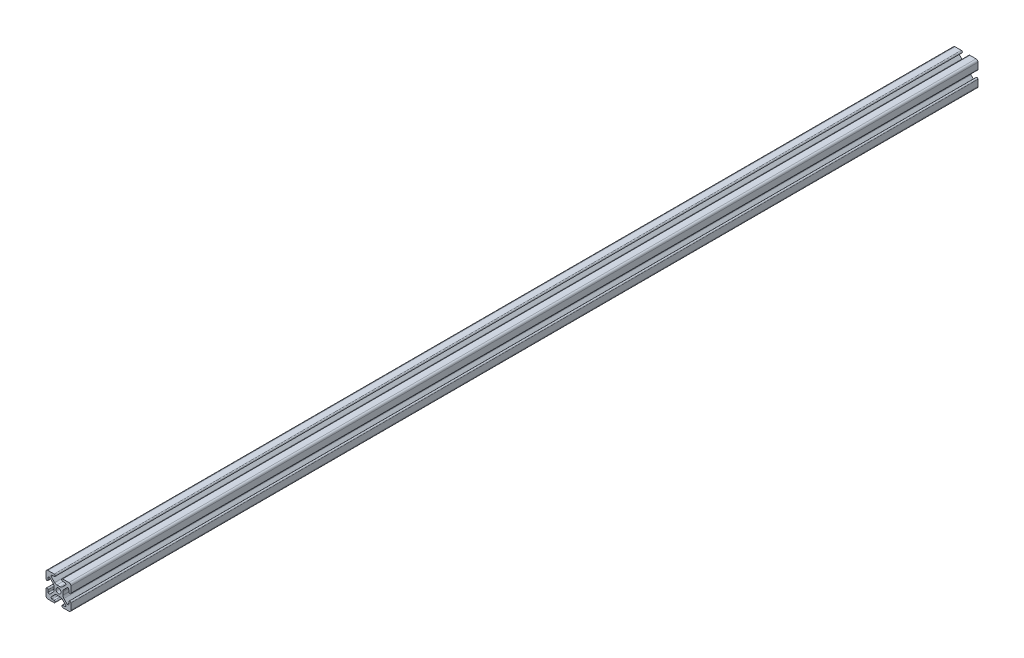
from build123d import *

# Parameters (mm, degrees)
SKETCH1_R      = 2.5
EXTRUDE1_DEPTH = 911


with BuildPart() as part:
    # Sketch1 → Extrude1 (new body)
    with BuildSketch(Plane.XY):
        with BuildLine():
            Line((-8.636346088, 7.111588351), (-5.432204773, 3.912143135))
            ThreePointArc((-5.432204773, 3.912143135), (-4.708985779, 2.831057106), (-4.455, 1.555406707))
            Line((-4.455, 1.555406707), (-4.455, -1.555406707))
            ThreePointArc((-4.455, -1.555406707), (-4.708985779, -2.831057106), (-5.432204773, -3.912143135))
            Line((-5.432204773, -3.912143135), (-8.636346088, -7.111588351))
            ThreePointArc((-8.636346088, -7.111588351), (-9.736852394, -7.329863489), (-10.36, -6.396886949))
            Line((-10.36, -6.396886949), (-10.36, -4.32))
            ThreePointArc((-10.36, -4.32), (-11.43, -3.25), (-12.5, -4.32))
            Line((-12.5, -4.32), (-12.5, -8.651801989))
            Line((-12.5, -8.651801989), (-12.5, -10.537068835))
            ThreePointArc((-12.5, -10.537068835), (-11.925070773, -11.925070773), (-10.537068835, -12.5))
            Line((-10.537068835, -12.5), (-8.441567612, -12.5))
            Line((-8.441567612, -12.5), (-4.387856959, -12.5))
            ThreePointArc((-4.387856959, -12.5), (-3.317856959, -11.43), (-4.387856959, -10.36))
            Line((-4.387856959, -10.36), (-6.42, -10.36))
            ThreePointArc((-6.42, -10.36), (-7.35325999, -9.736168088), (-7.133653912, -8.635298598))
            Line((-7.133653912, -8.635298598), (-3.795290766, -5.301828272))
            ThreePointArc((-3.795290766, -5.301828272), (-2.76743922, -4.61585726), (-1.555406707, -4.375))
            Line((-1.555406707, -4.375), (1.555406707, -4.375))
            ThreePointArc((1.555406707, -4.375), (2.76743922, -4.61585726), (3.795290766, -5.301828272))
            Line((3.795290766, -5.301828272), (7.133653912, -8.635298598))
            ThreePointArc((7.133653912, -8.635298598), (7.35325999, -9.736168088), (6.42, -10.36))
            Line((6.42, -10.36), (4.387856959, -10.36))
            ThreePointArc((4.387856959, -10.36), (3.317856959, -11.43), (4.387856959, -12.5))
            Line((4.387856959, -12.5), (8.441567612, -12.5))
            Line((8.441567612, -12.5), (10.537068835, -12.5))
            ThreePointArc((10.537068835, -12.5), (11.925070773, -11.925070773), (12.5, -10.537068835))
            Line((12.5, -10.537068835), (12.5, -8.651801989))
            Line((12.5, -8.651801989), (12.5, -4.32))
            ThreePointArc((12.5, -4.32), (11.43, -3.25), (10.36, -4.32))
            Line((10.36, -4.32), (10.36, -6.396886949))
            ThreePointArc((10.36, -6.396886949), (9.736852394, -7.329863489), (8.636346088, -7.111588351))
            Line((8.636346088, -7.111588351), (5.432204773, -3.912143135))
            ThreePointArc((5.432204773, -3.912143135), (4.708985779, -2.831057106), (4.455, -1.555406707))
            Line((4.455, -1.555406707), (4.455, 1.555406707))
            ThreePointArc((4.455, 1.555406707), (4.708985779, 2.831057106), (5.432204773, 3.912143135))
            Line((5.432204773, 3.912143135), (8.636346088, 7.111588351))
            ThreePointArc((8.636346088, 7.111588351), (9.736852394, 7.329863489), (10.36, 6.396886949))
            Line((10.36, 6.396886949), (10.36, 4.32))
            ThreePointArc((10.36, 4.32), (11.43, 3.25), (12.5, 4.32))
            Line((12.5, 4.32), (12.5, 7.99129648))
            Line((12.5, 7.99129648), (12.5, 10.537068835))
            ThreePointArc((12.5, 10.537068835), (11.925070773, 11.925070773), (10.537068835, 12.5))
            Line((10.537068835, 12.5), (4.32, 12.5))
            ThreePointArc((4.32, 12.5), (3.25, 11.43), (4.32, 10.36))
            Line((4.32, 10.36), (6.42, 10.36))
            ThreePointArc((6.42, 10.36), (7.35325999, 9.736168088), (7.133653912, 8.635298598))
            Line((7.133653912, 8.635298598), (3.795290766, 5.301828272))
            ThreePointArc((3.795290766, 5.301828272), (2.76743922, 4.61585726), (1.555406707, 4.375))
            Line((1.555406707, 4.375), (-1.555406707, 4.375))
            ThreePointArc((-1.555406707, 4.375), (-2.76743922, 4.61585726), (-3.795290766, 5.301828272))
            Line((-3.795290766, 5.301828272), (-7.133653912, 8.635298598))
            ThreePointArc((-7.133653912, 8.635298598), (-7.35325999, 9.736168088), (-6.42, 10.36))
            Line((-6.42, 10.36), (-4.32, 10.36))
            ThreePointArc((-4.32, 10.36), (-3.25, 11.43), (-4.32, 12.5))
            Line((-4.32, 12.5), (-10.537068835, 12.5))
            ThreePointArc((-10.537068835, 12.5), (-11.925070773, 11.925070773), (-12.5, 10.537068835))
            Line((-12.5, 10.537068835), (-12.5, 7.99129648))
            Line((-12.5, 7.99129648), (-12.5, 4.32))
            ThreePointArc((-12.5, 4.32), (-11.43, 3.25), (-10.36, 4.32))
            Line((-10.36, 4.32), (-10.36, 6.396886949))
            ThreePointArc((-10.36, 6.396886949), (-9.736852394, 7.329863489), (-8.636346088, 7.111588351))
        make_face()
        Circle(SKETCH1_R, mode=Mode.SUBTRACT)
    extrude(amount=-EXTRUDE1_DEPTH)


solid = part.part
